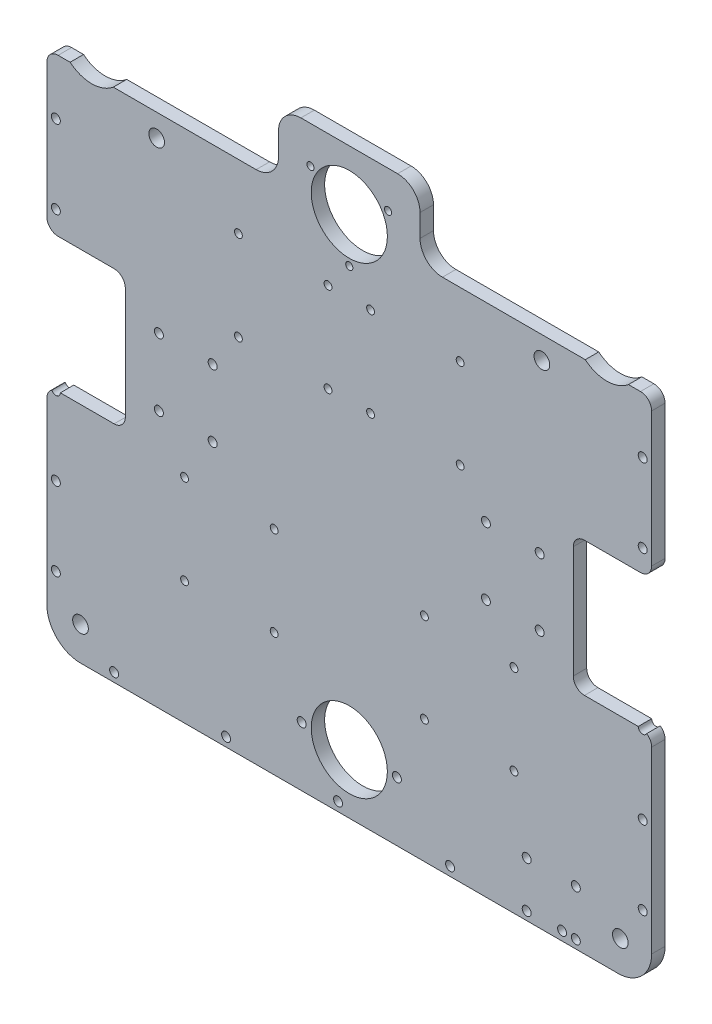
from build123d import *

# Parameters (mm, degrees)
SKETCH1_W            = 270
SKETCH1_H            = 260
BOSS_EXTRUDE1_DEPTH  = 6
SKETCH2_R            = 2
SKETCH2_W            = 35
SKETCH2_H            = 60
CUT_EXTRUDE1_DEPTH   = 188.512666239
SKETCH3_R            = 17
CUT_EXTRUDE2_DEPTH   = 188.512666239
SKETCH4_R            = 2
CUT_EXTRUDE3_DEPTH   = 188.512666239
SKETCH5_R            = 2
CUT_EXTRUDE4_DEPTH   = 188.512666239
FILLET1_R            = 15
SKETCH6_R            = 12.5
CUT_EXTRUDE5_DEPTH   = 188.512666239
SKETCH8_R            = 1.75
CUT_EXTRUDE6_DEPTH   = 188.512666239
SKETCH9_R            = 12.5
CUT_EXTRUDE7_DEPTH   = 188.512666239
SKETCH10_W           = 103.406579867
SKETCH10_H           = 30
CUT_EXTRUDE8_DEPTH   = 188.512666239
FILLET2_R            = 10
FILLET2_OF_MIRROR3_R = 10
SKETCH11_R           = 1.6
SKETCH11_R_2         = 3.5
CUT_EXTRUDE9_DEPTH   = 188.512666239
SKETCH12_R           = 15
CUT_EXTRUDE10_DEPTH  = 188.512666239
FILLET3_R            = 5
FILLET4_R            = 5
SKETCH13_R           = 1.75
SKETCH13_R_2         = 2
CUT_EXTRUDE11_DEPTH  = 188.512666239


with BuildPart() as part:
    # Sketch1 → Boss-Extrude1 (new body)
    with BuildSketch(Plane.XY):
        Rectangle(SKETCH1_W, SKETCH1_H)
    extrude(amount=BOSS_EXTRUDE1_DEPTH)

    # Sketch2 → Cut-Extrude1 (cut, through all)
    with BuildSketch(Plane.XY.offset(6)):
        with Locations((-85, 15)):
            Circle(SKETCH2_R)
        with Locations((-61, 15)):
            Circle(SKETCH2_R)
        with Locations((-61, -15)):
            Circle(SKETCH2_R)
        with Locations((-85, -15)):
            Circle(SKETCH2_R)
        with Locations((-117.5, 0)):
            Rectangle(SKETCH2_W, SKETCH2_H)
    cut_extrude1 = extrude(amount=-CUT_EXTRUDE1_DEPTH, mode=Mode.SUBTRACT)

    # Sketch3 → Cut-Extrude2 (cut, through all)
    with BuildSketch(Plane.XY.offset(6)):
        with Locations((0, -103.5)):
            Circle(SKETCH3_R)
    cut_extrude2 = extrude(amount=-CUT_EXTRUDE2_DEPTH, mode=Mode.SUBTRACT)

    # Mirror1: Cut-Extrude1 across plane
    add(cut_extrude1.mirror(Plane(origin=(0, 0, 0), x_dir=(0, 0, 1), z_dir=(1, 0, 0))), mode=Mode.SUBTRACT)

    # Mirror2: Cut-Extrude2 across plane
    add(cut_extrude2.mirror(Plane.ZX), mode=Mode.SUBTRACT)

    # Sketch4 → Cut-Extrude3 (cut, through all)
    with BuildSketch(Plane.XY.offset(6)):
        with Locations((21.25, -103.5)):
            Circle(SKETCH4_R)
        with Locations((-21.25, -103.5)):
            Circle(SKETCH4_R)
    extrude(amount=-CUT_EXTRUDE3_DEPTH, mode=Mode.SUBTRACT)

    # Sketch5 → Cut-Extrude4 (cut, through all)
    with BuildSketch(Plane.XY.offset(6)):
        with Locations((79.206538854, -126.234773755)):
            Circle(SKETCH5_R)
        with Locations((79.206538854, -105.765226245)):
            Circle(SKETCH5_R)
        with Locations((101.138196901, -105.765226245)):
            Circle(SKETCH5_R)
        with Locations((101.138196901, -126.234773755)):
            Circle(SKETCH5_R)
    extrude(amount=-CUT_EXTRUDE4_DEPTH, mode=Mode.SUBTRACT)

    # Fillet1
    fillet1_edges = [part.edges().sort_by_distance(p)[0] for p in [
        (135, -130, 3),
        (-135, -130, 3),
        (-135, 130, 3),
        (135, 130, 3),
    ]]
    fillet(fillet1_edges, radius=FILLET1_R)

    # Sketch6 → Cut-Extrude5 (cut, through all)
    with BuildSketch(Plane.XY.offset(6)):
        with Locations((-115, 115)):
            Circle(SKETCH6_R)
    extrude(amount=-CUT_EXTRUDE5_DEPTH, mode=Mode.SUBTRACT)

    # Sketch8 → Cut-Extrude6 (cut, through all)
    with BuildSketch(Plane.XY.offset(6)):
        with Locations((49.5, 31.3)):
            Circle(SKETCH8_R)
        with Locations((9.5, 31.3)):
            Circle(SKETCH8_R)
        with Locations((9.5, 71.3)):
            Circle(SKETCH8_R)
        with Locations((49.5, 71.3)):
            Circle(SKETCH8_R)
        with Locations((-49.5, 31.3)):
            Circle(SKETCH8_R)
        with Locations((-9.5, 31.3)):
            Circle(SKETCH8_R)
        with Locations((-49.5, 71.3)):
            Circle(SKETCH8_R)
        with Locations((-9.5, 71.3)):
            Circle(SKETCH8_R)
    extrude(amount=-CUT_EXTRUDE6_DEPTH, mode=Mode.SUBTRACT)

    # Sketch9 → Cut-Extrude7 (cut, through all)
    with BuildSketch(Plane.XY.offset(6)):
        with Locations((115, 111.5)):
            Circle(SKETCH9_R)
    extrude(amount=-CUT_EXTRUDE7_DEPTH, mode=Mode.SUBTRACT)

    # Sketch10 → Cut-Extrude8 (cut, through all)
    with BuildSketch(Plane.XY.offset(6)):
        with Locations((83.296710066, 115)):
            Rectangle(SKETCH10_W, SKETCH10_H)
    cut_extrude8 = extrude(amount=-CUT_EXTRUDE8_DEPTH, mode=Mode.SUBTRACT)

    # Fillet2
    fillet2_edges = [part.edges().sort_by_distance(p)[0] for p in [
        (31.593420133, 100, 3),
        (31.593420133, 130, 3),
    ]]
    fillet(fillet2_edges, radius=FILLET2_R)

    # Mirror3: Cut-Extrude8 across plane
    add(cut_extrude8.mirror(Plane.ZY), mode=Mode.SUBTRACT)

    # Fillet2 of Mirror3
    fillet2_of_mirror3_edges = [part.edges().sort_by_distance(p)[0] for p in [
        (-31.593420133, 100, 3),
        (-31.593420133, 130, 3),
    ]]
    fillet(fillet2_of_mirror3_edges, radius=FILLET2_OF_MIRROR3_R)

    # Sketch11 → Cut-Extrude9 (cut, through all)
    with BuildSketch(Plane.XY.offset(6)):
        with Locations((-17.320508076, 113.5)):
            Circle(SKETCH11_R)
        with Locations((17.320508076, 113.5)):
            Circle(SKETCH11_R)
        with Locations((0, 83.5)):
            Circle(SKETCH11_R)
        with Locations((86, 90)):
            Circle(SKETCH11_R_2)
        with Locations((-86, 90)):
            Circle(SKETCH11_R_2)
        with Locations((121, -116)):
            Circle(SKETCH11_R_2)
        with Locations((-120, -115)):
            Circle(SKETCH11_R_2)
    extrude(amount=-CUT_EXTRUDE9_DEPTH, mode=Mode.SUBTRACT)

    # Sketch12 → Cut-Extrude10 (cut, through all)
    with BuildSketch(Plane.XY.offset(6)):
        with Locations((115, 111.5)):
            Circle(SKETCH12_R)
        with Locations((-115, 111.5)):
            Circle(SKETCH12_R)
    extrude(amount=-CUT_EXTRUDE10_DEPTH, mode=Mode.SUBTRACT)

    # Fillet3
    fillet3_edges = [part.edges().sort_by_distance(p)[0] for p in [
        (135, 100, 3),
        (-135, 100, 3),
    ]]
    fillet(fillet3_edges, radius=FILLET3_R)

    # Fillet4
    fillet4_edges = [part.edges().sort_by_distance(p)[0] for p in [
        (-100, 30, 3),
        (-100, -30, 3),
        (-135, -30, 3),
        (-135, 30, 3),
        (100, -30, 3),
        (100, 30, 3),
        (135, 30, 3),
        (135, -30, 3),
    ]]
    fillet(fillet4_edges, radius=FILLET4_R)

    # Sketch13 → Cut-Extrude11 (cut, through all)
    with BuildSketch(Plane.XY.offset(6)):
        with Locations((33.544641935, -34.940258228)):
            Circle(SKETCH13_R)
        with Locations((73.544641935, -34.940258228)):
            Circle(SKETCH13_R)
        with Locations((73.544641935, -74.940258228)):
            Circle(SKETCH13_R)
        with Locations((33.544641935, -74.940258228)):
            Circle(SKETCH13_R)
        with Locations(Location((-33.544641935, -74.940258228, 0), (0, 0, 180))):
            Circle(SKETCH13_R)
        with Locations(Location((-73.544641935, -74.940258228, 0), (0, 0, 180))):
            Circle(SKETCH13_R)
        with Locations(Location((-73.544641935, -34.940258228, 0), (0, 0, 180))):
            Circle(SKETCH13_R)
        with Locations(Location((-33.544641935, -34.940258228, 0), (0, 0, 180))):
            Circle(SKETCH13_R)
        with Locations((-131, -100)):
            Circle(SKETCH13_R_2)
        with Locations((-131, -65)):
            Circle(SKETCH13_R_2)
        with Locations((-131, -30)):
            Circle(SKETCH13_R_2)
        with Locations((-131, 5)):
            Circle(SKETCH13_R_2)
        with Locations((-131, 40)):
            Circle(SKETCH13_R_2)
        with Locations((-131, 75)):
            Circle(SKETCH13_R_2)
        with Locations((-105, -126)):
            Circle(SKETCH13_R_2)
        with Locations((-55, -126)):
            Circle(SKETCH13_R_2)
        with Locations((-5, -126)):
            Circle(SKETCH13_R_2)
        with Locations((45, -126)):
            Circle(SKETCH13_R_2)
        with Locations((95, -126)):
            Circle(SKETCH13_R_2)
        with Locations((145, -126)):
            Circle(SKETCH13_R_2)
        with Locations((195, -126)):
            Circle(SKETCH13_R_2)
        with Locations((245, -126)):
            Circle(SKETCH13_R_2)
        with Locations((295, -126)):
            Circle(SKETCH13_R_2)
        with Locations((345, -126)):
            Circle(SKETCH13_R_2)
        with Locations((395, -126)):
            Circle(SKETCH13_R_2)
        with Locations((445, -126)):
            Circle(SKETCH13_R_2)
        with Locations((495, -126)):
            Circle(SKETCH13_R_2)
        with Locations(Location((131, 75, 0), (0, 0, 180))):
            Circle(SKETCH13_R_2)
        with Locations(Location((131, 40, 0), (0, 0, 180))):
            Circle(SKETCH13_R_2)
        with Locations((131, 5)):
            Circle(SKETCH13_R_2)
        with Locations((131, -30)):
            Circle(SKETCH13_R_2)
        with Locations(Location((131, -65, 0), (0, 0, 180))):
            Circle(SKETCH13_R_2)
        with Locations(Location((131, -100, 0), (0, 0, 180))):
            Circle(SKETCH13_R_2)
    extrude(amount=-CUT_EXTRUDE11_DEPTH, mode=Mode.SUBTRACT)


solid = part.part
